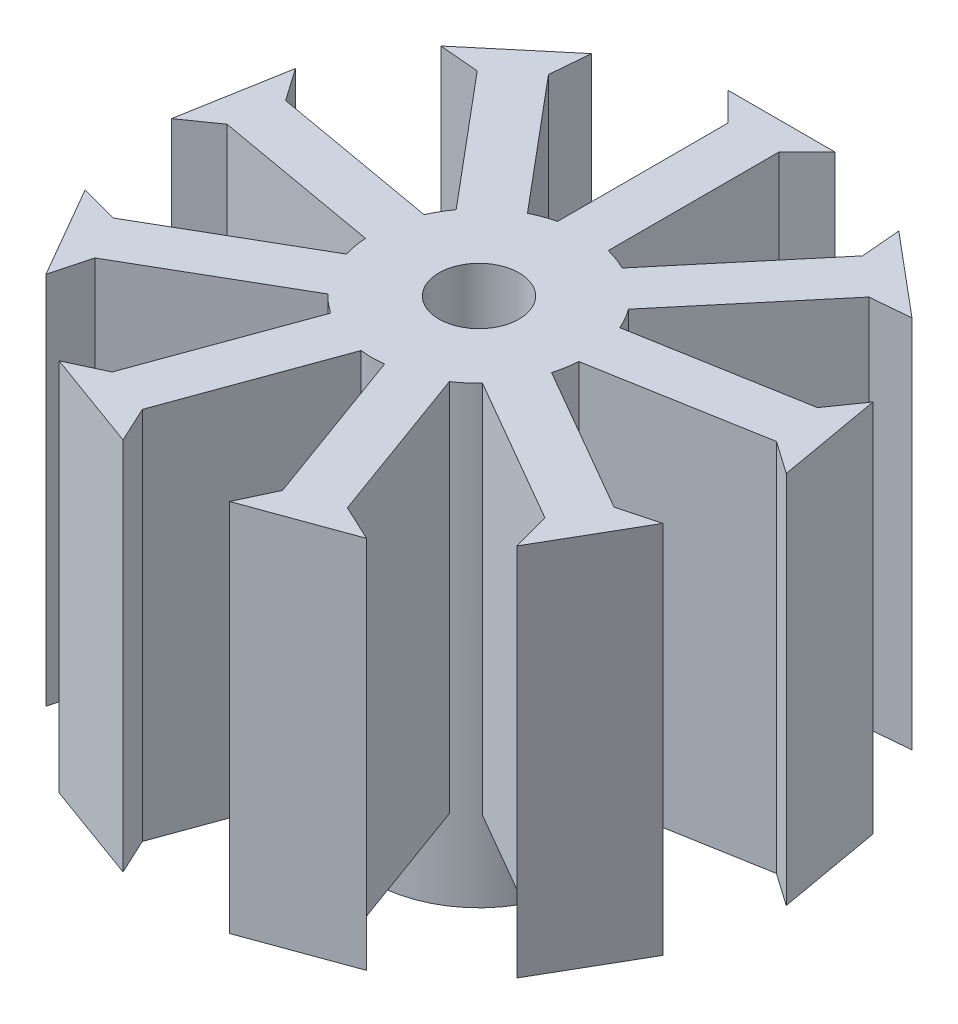
from build123d import *

# Parameters (mm, degrees)
SCHIZZO1_R                   = 4
ESTRUSIONE_ESTRUSIONE1_DEPTH = 3
ESTRUSIONE_ESTRUSIONE2_DEPTH = 14
SCHIZZO3_R                   = 1.5
TAGLIO_ESTRUSIONE1_DEPTH     = 32


with BuildPart() as part:
    # Schizzo1 → Estrusione-Estrusione1 (new body)
    with BuildSketch(Plane(origin=(0, 0, 0), x_dir=(1, 0, 0), z_dir=(0, 1, 0))):
        with Locations(Location((0, 0, 0), (0, 0, 270))):
            Circle(SCHIZZO1_R)
    extrude(amount=ESTRUSIONE_ESTRUSIONE1_DEPTH)

    # Schizzo2 → Estrusione-Estrusione2 (add)
    with BuildSketch(Plane(origin=(0, 3, 0), x_dir=(1, 0, 0), z_dir=(0, 1, 0))):
        with BuildLine():
            Line((5.877166346, 8.476701011), (1.77302735, 3.585578617))
            ThreePointArc((1.77302735, 3.585578617), (1.368080573, 3.758770483), (0.94654776, 3.886392587))
            Line((0.94654776, 3.886392587), (0.94654776, 10.271299413))
            Line((0.94654776, 10.271299413), (2, 11.324751653))
            Line((2, 11.324751653), (-2, 11.324751653))
            Line((-2, 11.324751653), (-0.94654776, 10.271299413))
            Line((-0.94654776, 10.271299413), (-0.94654776, 3.886392587))
            ThreePointArc((-0.94654776, 3.886392587), (-1.368080573, 3.758770483), (-1.77302735, 3.585578617))
            Line((-1.77302735, 3.585578617), (-5.877166346, 8.476701011))
            Line((-5.877166346, 8.476701011), (-5.747321159, 9.960838293))
            Line((-5.747321159, 9.960838293), (-8.811498932, 7.389687854))
            Line((-8.811498932, 7.389687854), (-7.327361649, 7.259842667))
            Line((-7.327361649, 7.259842667), (-3.223222653, 2.368720273))
            ThreePointArc((-3.223222653, 2.368720273), (-3.464101615, 2), (-3.662983257, 1.607032563))
            Line((-3.662983257, 1.607032563), (-9.950889001, 2.715759998))
            Line((-9.950889001, 2.715759998), (-10.805406873, 3.936137993))
            Line((-10.805406873, 3.936137993), (-11.499999584, -0.003093019))
            Line((-11.499999584, -0.003093019), (-10.279621589, 0.851424853))
            Line((-10.279621589, 0.851424853), (-3.991715844, -0.257302582))
            ThreePointArc((-3.991715844, -0.257302582), (-3.939231012, -0.694592711), (-3.838988589, -1.123461888))
            Line((-3.838988589, -1.123461888), (-9.368480101, -4.315915301))
            Line((-9.368480101, -4.315915301), (-10.807522623, -3.930325019))
            Line((-10.807522623, -3.930325019), (-8.807522623, -7.394426634))
            Line((-8.807522623, -7.394426634), (-8.421932341, -5.955384112))
            Line((-8.421932341, -5.955384112), (-2.892440829, -2.762930699))
            ThreePointArc((-2.892440829, -2.762930699), (-2.571150439, -3.064177772), (-2.218688495, -3.328276035))
            Line((-2.218688495, -3.328276035), (-4.402455242, -9.328125863))
            Line((-4.402455242, -9.328125863), (-5.752678425, -9.957745274))
            Line((-5.752678425, -9.957745274), (-1.993907942, -11.325825847))
            Line((-1.993907942, -11.325825847), (-2.623527352, -9.975602664))
            Line((-2.623527352, -9.975602664), (-0.439760605, -3.975752836))
            ThreePointArc((-0.439760605, -3.975752836), (0, -4), (0.439760605, -3.975752836))
            Line((0.439760605, -3.975752836), (2.623527352, -9.975602664))
            Line((2.623527352, -9.975602664), (1.993907942, -11.325825847))
            Line((1.993907942, -11.325825847), (5.752678425, -9.957745274))
            Line((5.752678425, -9.957745274), (4.402455242, -9.328125863))
            Line((4.402455242, -9.328125863), (2.218688495, -3.328276035))
            ThreePointArc((2.218688495, -3.328276035), (2.571150439, -3.064177772), (2.892440829, -2.762930699))
            Line((2.892440829, -2.762930699), (8.421932341, -5.955384112))
            Line((8.421932341, -5.955384112), (8.807522623, -7.394426634))
            Line((8.807522623, -7.394426634), (10.807522623, -3.930325019))
            Line((10.807522623, -3.930325019), (9.368480101, -4.315915301))
            Line((9.368480101, -4.315915301), (3.838988589, -1.123461888))
            ThreePointArc((3.838988589, -1.123461888), (3.939231012, -0.694592711), (3.991715844, -0.257302582))
            Line((3.991715844, -0.257302582), (10.279621589, 0.851424853))
            Line((10.279621589, 0.851424853), (11.499999584, -0.003093019))
            Line((11.499999584, -0.003093019), (10.805406873, 3.936137993))
            Line((10.805406873, 3.936137993), (9.950889001, 2.715759998))
            Line((9.950889001, 2.715759998), (3.662983257, 1.607032563))
            ThreePointArc((3.662983257, 1.607032563), (3.464101615, 2), (3.223222653, 2.368720273))
            Line((3.223222653, 2.368720273), (7.327361649, 7.259842667))
            Line((7.327361649, 7.259842667), (8.811498932, 7.389687854))
            Line((8.811498932, 7.389687854), (5.747321159, 9.960838293))
            Line((5.747321159, 9.960838293), (5.877166346, 8.476701011))
        make_face()
    extrude(amount=ESTRUSIONE_ESTRUSIONE2_DEPTH)

    # Schizzo3 → Taglio-Estrusione1 (cut)
    with BuildSketch(Plane(origin=(0, 17, 0), x_dir=(1, 0, 0), z_dir=(0, 1, 0))):
        with Locations(Location((0, 0, 0), (0, 0, 270))):
            Circle(SCHIZZO3_R)
    extrude(amount=-TAGLIO_ESTRUSIONE1_DEPTH, mode=Mode.SUBTRACT)


solid = part.part
